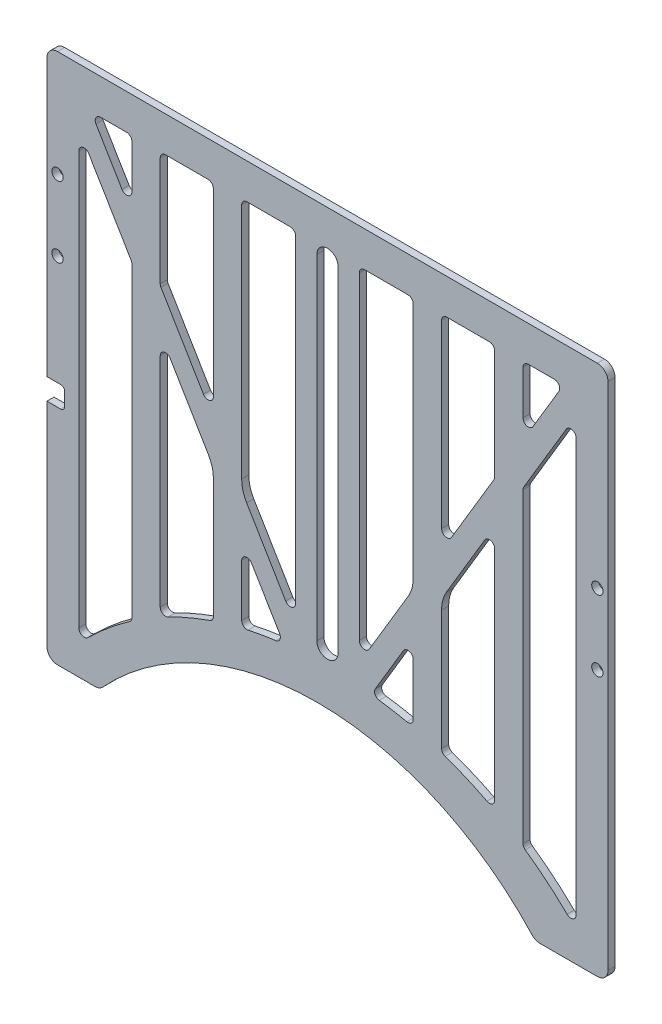
from build123d import *

# Parameters (mm, degrees)
SKETCH_1_W          = 158.45
SKETCH_1_H          = 150
EXTRUDE_1_DEPTH     = 2
SKETCH_2_R          = 82.5
CUT_EXTRUDE_1_DEPTH = 10
SKETCH_4_W          = 10
SKETCH_4_H          = 6
CUT_EXTRUDE_2_DEPTH = 10
FILLET_1_R          = 1.1
SKETCH_5_R          = 1.6
CUT_EXTRUDE_3_DEPTH = 10
CUT_EXTRUDE_4_DEPTH = 10
EXTRUDE_2_DEPTH     = 2
FILLET_2_R          = 1.5
FILLET_3_R          = 10
FILLET_4_R          = 3
CUT_EXTRUDE_5_DEPTH = 10


with BuildPart() as part:
    # 草图1 → 凸台-拉伸1 (new body)
    with BuildSketch(Plane.XY):
        Rectangle(SKETCH_1_W, SKETCH_1_H)
    extrude(amount=EXTRUDE_1_DEPTH)

    # 草图2 → 切除-拉伸1 (cut)
    with BuildSketch(Plane(origin=(0, 0, 0), x_dir=(-1, 0, 0), z_dir=(0, 0, -1))):
        with Locations((2.825, -130)):
            Circle(SKETCH_2_R)
    extrude(amount=-CUT_EXTRUDE_1_DEPTH, mode=Mode.SUBTRACT)

    # 草图4 → 切除-拉伸2 (cut)
    with BuildSketch(Plane(origin=(0, 0, 0), x_dir=(-1, 0, 0), z_dir=(0, 0, -1))):
        with Locations((79.225, -9)):
            Rectangle(SKETCH_4_W, SKETCH_4_H)
    extrude(amount=-CUT_EXTRUDE_2_DEPTH, mode=Mode.SUBTRACT)

    # 圆角1
    fillet_1_edges = [part.edges().sort_by_distance(p)[0] for p in [
        (-74.225, -12, 1),
        (-74.225, -6, 1),
    ]]
    fillet(fillet_1_edges, radius=FILLET_1_R)

    # 草图5 → 切除-拉伸3 (cut)
    with BuildSketch(Plane.XY.offset(2)):
        with Locations((76.225, 20)):
            Circle(SKETCH_5_R)
        with Locations((76.225, 0)):
            Circle(SKETCH_5_R)
        with Locations((-76.225, 45)):
            Circle(SKETCH_5_R)
        with Locations((-76.225, 25)):
            Circle(SKETCH_5_R)
    extrude(amount=-CUT_EXTRUDE_3_DEPTH, mode=Mode.SUBTRACT)

    # 草图6 → 切除-拉伸4 (cut)
    with BuildSketch(Plane.XY.offset(2)):
        with BuildLine():
            Line((-55.225, 65), (-70.225, 65))
            Line((-70.225, 65), (-70.225, -66.647888749))
            ThreePointArc((-70.225, -66.647888749), (-63.069899561, -59.80881767), (-55.225, -53.773429829))
            Line((-55.225, -53.773429829), (-55.225, 65))
        make_face()
        with BuildLine():
            Line((-32.225, 65), (-47.225, 65))
            Line((-47.225, 65), (-47.225, -48.852664862))
            ThreePointArc((-47.225, -48.852664862), (-39.870317713, -45.242142337), (-32.225, -42.296579314))
            Line((-32.225, -42.296579314), (-32.225, 65))
        make_face()
        with BuildLine():
            Line((-9, 65), (-24.225, 65))
            Line((-24.225, 65), (-24.225, -40.009500501))
            ThreePointArc((-24.225, -40.009500501), (-16.660508355, -38.540562496), (-9, -37.706341632))
            Line((-9, -37.706341632), (-9, 65))
        make_face()
    cut_extrude_4 = extrude(amount=-CUT_EXTRUDE_4_DEPTH, mode=Mode.SUBTRACT)

    # 镜向1: 切除-拉伸4 across plane
    add(cut_extrude_4.mirror(Plane(origin=(0, 0, 0), x_dir=(0, 0, 1), z_dir=(1, 0, 0))), mode=Mode.SUBTRACT)

    # 草图7 → 凸台-拉伸2 (add)
    with BuildSketch(Plane.XY.offset(2)):
        Polygon((-72.801882642, 63.463876356), (-11.576882642, -39.242465276), (-6.423117358, -36.170217988), (-67.648117358, 66.536123644), align=None)
        Polygon((67.648117358, 66.536123644), (6.423117358, -36.170217988), (11.576882642, -39.242465276), (72.801882642, 63.463876356), align=None)
    extrude(amount=-EXTRUDE_2_DEPTH)

    # 圆角2
    fillet_2_edges = [part.edges().sort_by_distance(p)[0] for p in [
        (-32.225, -42.296579314, 1),
        (-47.225, -48.852664862, 1),
        (-47.225, 65, 1),
        (-32.225, 65, 1),
        (-24.225, -40.009500501, 1),
        (-24.225, 65, 1),
        (-9, 65, 1),
        (70.225, -66.647888749, 1),
        (55.225, -53.773429829, 1),
        (55.225, 65, 1),
        (47.225, -48.852664862, 1),
        (32.225, -42.296579314, 1),
        (32.225, 65, 1),
        (47.225, 65, 1),
        (24.225, -40.009500501, 1),
        (9, 65, 1),
        (24.225, 65, 1),
        (-55.225, 45.696059365, 1),
        (-55.225, 33.978252617, 1),
        (-12.32407353, -37.989035425, 1),
        (-24.225, -18.024958336, 1),
        (-47.225, 20.558069145, 1),
        (-9, -31.847438258, 1),
        (-32.225, 7.113031883, 1),
        (-47.225, 32.275875893, 1),
        (-70.225, 59.141096626, 1),
        (-66.732407884, 65, 1),
        (70.225, 59.141096626, 1),
        (66.732407884, 65, 1),
        (32.225, 7.113031883, 1),
        (47.225, 32.275875893, 1),
        (55.225, 45.696059365, 1),
        (9, -31.847438258, 1),
        (24.225, -18.024958336, 1),
        (47.225, 20.558069145, 1),
        (55.225, 33.978252617, 1),
        (12.32407353, -37.989035425, 1),
        (-55.225, -53.773429829, 1),
        (-70.225, -66.647888749, 1),
        (-55.225, 65, 1),
    ]]
    fillet(fillet_2_edges, radius=FILLET_2_R)

    # 圆角3
    fillet_3_edges = [part.edges().sort_by_distance(p)[0] for p in [
        (-32.225, -4.604774864, 1),
        (-24.225, -6.307151588, 1),
        (24.225, -6.307151588, 1),
        (32.225, -4.604774864, 1),
    ]]
    fillet(fillet_3_edges, radius=FILLET_3_R)

    # 圆角4
    fillet_4_edges = [part.edges().sort_by_distance(p)[0] for p in [
        (58.666869381, -75, 1),
        (-64.316869381, -75, 1),
        (79.225, -75, 1),
        (-79.225, -75, 1),
        (-79.225, 75, 1),
        (79.225, 75, 1),
    ]]
    fillet(fillet_4_edges, radius=FILLET_4_R)

    # 草图10 → 切除-拉伸5 (cut)
    with BuildSketch(Plane.XY.offset(2)):
        with BuildLine():
            Line((3, 62), (3, -32.5))
            ThreePointArc((3, -32.5), (0, -35.5), (-3, -32.5))
            Line((-3, -32.5), (-3, 62))
            ThreePointArc((-3, 62), (0, 65), (3, 62))
        make_face()
    extrude(amount=-CUT_EXTRUDE_5_DEPTH, mode=Mode.SUBTRACT)


solid = part.part
